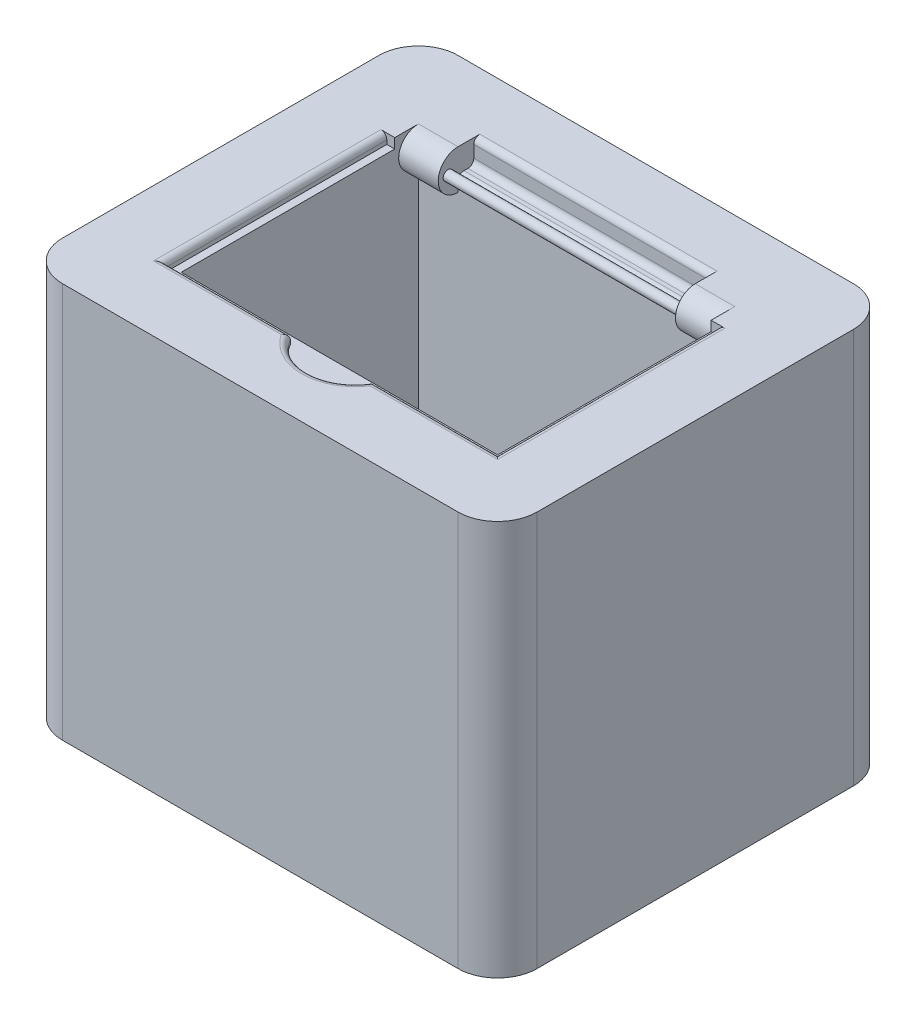
from build123d import *

# Parameters (mm, degrees)
BOSS_EXTRUDE1_DEPTH      = 90
BOSS_EXTRUDE1_DEPTH_BACK = 10
SKETCH1_W                = 120
SKETCH1_H                = 100
FILLET1_R                = 10
SKETCH2_W                = 80
SKETCH2_H                = 60
CUT_EXTRUDE1_DEPTH       = 127.885775404
SKETCH3_W                = 106.2
SKETCH3_H                = 86.2
SKETCH3_W_2              = 93.8
SKETCH3_H_2              = 73.8
CUT_EXTRUDE2_DEPTH       = 10
BOSS_EXTRUDE3_START      = -20
BOSS_EXTRUDE3_DEPTH      = 80
CUT_EXTRUDE3_START       = -30
SKETCH5_R                = 1.25
CUT_EXTRUDE3_DEPTH       = 60
CUT_EXTRUDE4_DEPTH       = 2.5
SKETCH7_W                = 60
SKETCH7_H                = 4
CUT_EXTRUDE5_DEPTH       = 6
FILLET2_R                = 1.5


with BuildPart() as part:
    # Sketch1 → Boss-Extrude1 (new, two sides: drawn at the far end of the back side and taken through both)
    with BuildSketch(Plane(origin=(0, 0, 0), x_dir=(1, 0, 0), z_dir=(0, 1, 0)).offset(-BOSS_EXTRUDE1_DEPTH_BACK)):
        Rectangle(SKETCH1_W, SKETCH1_H)
    extrude(amount=BOSS_EXTRUDE1_DEPTH + BOSS_EXTRUDE1_DEPTH_BACK)

    # Fillet1
    fillet1_edges = [part.edges().sort_by_distance(p)[0] for p in [
        (-60, 40, -50),
        (60, 40, -50),
        (60, 40, 50),
        (-60, 40, 50),
    ]]
    fillet(fillet1_edges, radius=FILLET1_R)

    # Sketch2 → Cut-Extrude1 (cut, through all)
    with BuildSketch(Plane(origin=(0, 90, 0), x_dir=(1, 0, 0), z_dir=(0, 1, 0))):
        Rectangle(SKETCH2_W, SKETCH2_H)
    extrude(amount=-CUT_EXTRUDE1_DEPTH, mode=Mode.SUBTRACT)

    # Sketch3 → Cut-Extrude2 (cut)
    with BuildSketch(Plane.XZ.offset(10)):
        Rectangle(SKETCH3_W, SKETCH3_H)
        Rectangle(SKETCH3_W_2, SKETCH3_H_2, mode=Mode.SUBTRACT)
    extrude(amount=-CUT_EXTRUDE2_DEPTH, mode=Mode.SUBTRACT)

    # Sketch4 → Boss-Extrude3 (add)
    with BuildSketch(Plane(origin=(60, 0, 0), x_dir=(0, 0, -1), z_dir=(1, 0, 0)).offset(BOSS_EXTRUDE3_START)):
        with BuildLine():
            Line((30, 80), (30, 90))
            ThreePointArc((30, 90), (25, 85), (30, 80))
        make_face()
    extrude(amount=-BOSS_EXTRUDE3_DEPTH)

    # Sketch5 → Cut-Extrude3 (cut)
    with BuildSketch(Plane(origin=(60, 0, 0), x_dir=(0, 0, -1), z_dir=(1, 0, 0)).offset(CUT_EXTRUDE3_START)):
        with BuildLine():
            Line((30, 80), (30, 90))
            ThreePointArc((30, 90), (25, 85), (30, 80))
        make_face()
        with Locations((27.5, 85)):
            Circle(SKETCH5_R, mode=Mode.SUBTRACT)
    extrude(amount=-CUT_EXTRUDE3_DEPTH, mode=Mode.SUBTRACT)

    # Sketch6 → Cut-Extrude4 (cut)
    with BuildSketch(Plane(origin=(0, 90, 0), x_dir=(1, 0, 0), z_dir=(0, 1, 0))):
        with BuildLine():
            Line((-40, -30), (-40, 24))
            Line((-40, 24), (-42, 24))
            Line((-42, 24), (-42, -32))
            Line((-42, -32), (-10.392304845, -32))
            ThreePointArc((-10.392304845, -32), (0, -38), (10.392304845, -32))
            Line((10.392304845, -32), (42, -32))
            Line((42, -32), (42, 24))
            Line((42, 24), (40, 24))
            Line((40, 24), (40, -30))
            Line((40, -30), (-40, -30))
        make_face()
    extrude(amount=-CUT_EXTRUDE4_DEPTH, mode=Mode.SUBTRACT)

    # Sketch7 → Cut-Extrude5 (cut)
    with BuildSketch(Plane(origin=(0, 90, 0), x_dir=(1, 0, 0), z_dir=(0, 1, 0))):
        with Locations((0, 32)):
            Rectangle(SKETCH7_W, SKETCH7_H)
    extrude(amount=-CUT_EXTRUDE5_DEPTH, mode=Mode.SUBTRACT)

    # Fillet2
    fillet2_edges = [part.edges().sort_by_distance(p)[0] for p in [
        (-42, 90, 4),
        (-26.196152423, 90, 32),
        (0, 90, 38),
        (26.196152423, 90, 32),
        (42, 90, 4),
        (0, 84, -34),
        (0, 84, -30),
        (0, 90, -34),
    ]]
    fillet(fillet2_edges, radius=FILLET2_R)


solid = part.part
